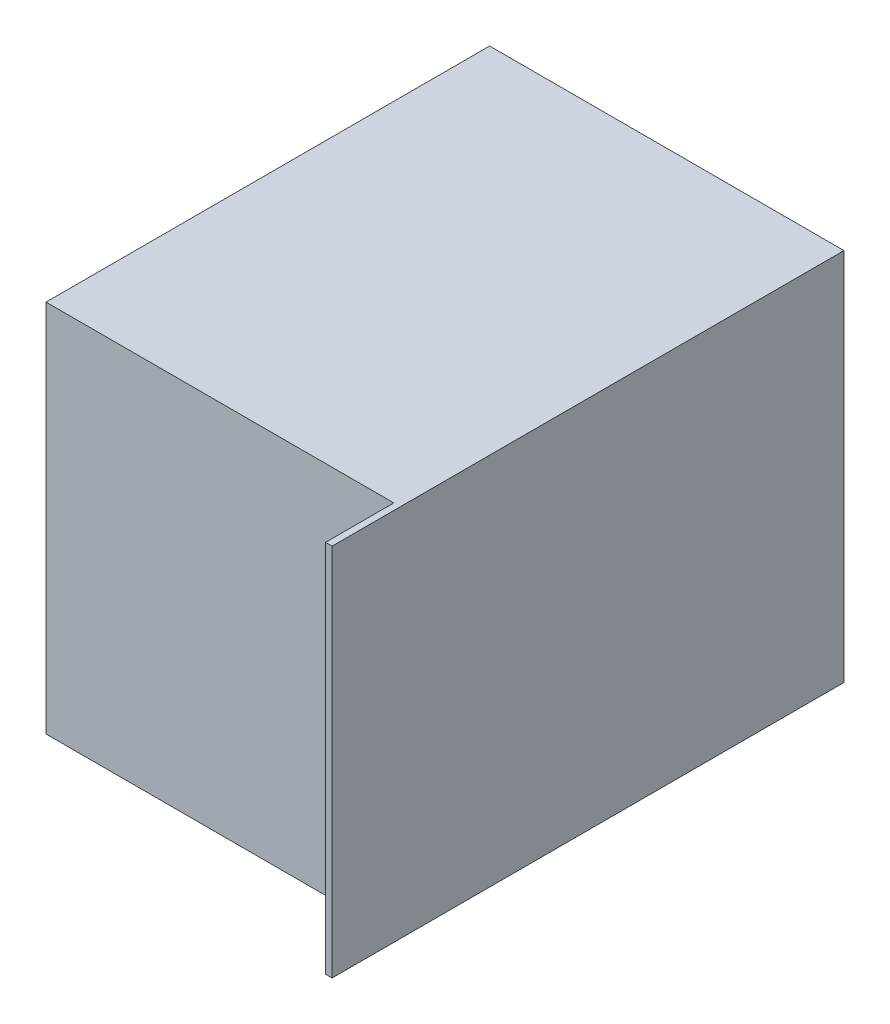
from build123d import *

# Parameters (mm, degrees)
RESSALTO_EXTRUS_O1_DEPTH = 57
ESBO_O2_R                = 1.75
CORTE_EXTRUS_O1_DEPTH    = 10


with BuildPart() as part:
    # Esboço1 → Ressalto-extrusão1 (new body)
    with BuildSketch(Plane(origin=(0, 0, 0), x_dir=(1, 0, 0), z_dir=(0, 1, 0))):
        Polygon((-41.427385892, -28.6), (11.572614108, -28.6), (11.572614108, -39), (12.572614108, -39), (12.572614108, 39), (-41.427385892, 39), align=None)
    extrude(amount=RESSALTO_EXTRUS_O1_DEPTH)

    # Esboço2 → Corte-extrusão1 (cut)
    with BuildSketch(Plane.XZ):
        with Locations(Location((-31.677385892, 12.75, 0), (0, 0, 270))):
            Circle(ESBO_O2_R)
    extrude(amount=-CORTE_EXTRUS_O1_DEPTH, mode=Mode.SUBTRACT)


solid = part.part
